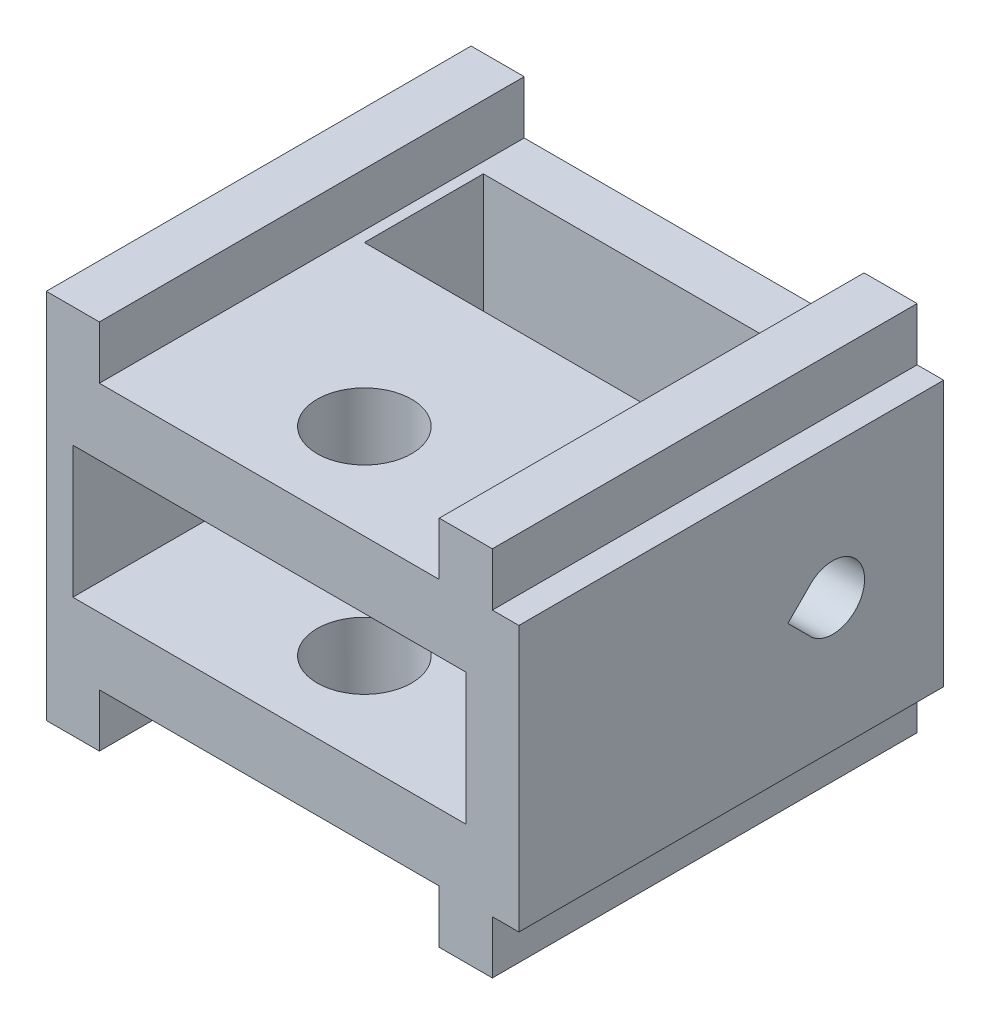
from build123d import *

# Parameters (mm, degrees)
SKETCH1_W               = 42
SKETCH1_H               = 40
BOSS_EXTRUDE1_DEPTH     = 25
SKETCH2_R               = 4.45
SKETCH2_W               = 30
SKETCH2_H               = 11.2
CUT_EXTRUDE1_DEPTH      = 25
SKETCH5_W               = 37
SKETCH5_H               = 12.4
CUT_EXTRUDE3_DEPTH      = 23.95
SKETCH7_W               = 5
SKETCH7_H               = 40
BOSS_EXTRUDE2_DEPTH     = 5
SKETCH8_W               = 5
SKETCH8_H               = 40
BOSS_EXTRUDE3_DEPTH     = 5
SKETCH10_W              = 40
SKETCH10_H              = 25
BOSS_EXTRUDE4_DEPTH     = 2.5
CUT_EXTRUDE2_DEPTH      = 66.743841816
CUT_EXTRUDE2_DEPTH_BACK = 66.743841816


with BuildPart() as part:
    # Sketch1 → Boss-Extrude1 (new body)
    with BuildSketch(Plane(origin=(0, 0, 0), x_dir=(-1, 0, 0), z_dir=(0, 1, 0))):
        with Locations((1.474226804, 20.721649485)):
            Rectangle(SKETCH1_W, SKETCH1_H)
    extrude(amount=BOSS_EXTRUDE1_DEPTH)

    # Sketch2 → Cut-Extrude1 (cut)
    with BuildSketch(Plane(origin=(0, 25, 0), x_dir=(-1, 0, 0), z_dir=(0, 1, 0))):
        with Locations(Location((1.474226804, 31.771649485, 0), (0, 0, 90))):
            Circle(SKETCH2_R)
        with Locations((1.474226804, 11.171649485)):
            Rectangle(SKETCH2_W, SKETCH2_H)
    extrude(amount=-CUT_EXTRUDE1_DEPTH, mode=Mode.SUBTRACT)

    # Sketch5 → Cut-Extrude3 (cut)
    with BuildSketch(Plane.XY.offset(40.721649485)):
        with Locations((-1.474226804, 12.5)):
            Rectangle(SKETCH5_W, SKETCH5_H)
    extrude(amount=-CUT_EXTRUDE3_DEPTH, mode=Mode.SUBTRACT)

    # Sketch7 → Boss-Extrude2 (add)
    with BuildSketch(Plane(origin=(0, 25, 0), x_dir=(-1, 0, 0), z_dir=(0, 1, 0))):
        with Locations((19.974226804, 20.721649485)):
            Rectangle(SKETCH7_W, SKETCH7_H)
        with Locations((-17.025773196, 20.721649485)):
            Rectangle(SKETCH7_W, SKETCH7_H)
    extrude(amount=BOSS_EXTRUDE2_DEPTH)

    # Sketch8 → Boss-Extrude3 (add)
    with BuildSketch(Plane.XZ):
        with Locations((-19.974226804, 20.721649485)):
            Rectangle(SKETCH8_W, SKETCH8_H)
        with Locations((17.025773196, 20.721649485)):
            Rectangle(SKETCH8_W, SKETCH8_H)
    extrude(amount=BOSS_EXTRUDE3_DEPTH)

    # Sketch10 → Boss-Extrude4 (add)
    with BuildSketch(Plane(origin=(19.525773196, 0, 0), x_dir=(0, 0, -1), z_dir=(1, 0, 0))):
        with Locations((-20.721649485, 12.5)):
            Rectangle(SKETCH10_W, SKETCH10_H)
    extrude(amount=BOSS_EXTRUDE4_DEPTH)

    # Sketch3 → Cut-Extrude2 (cut, two sides: drawn at the far end of the back side and taken through both)
    with BuildSketch(Plane.YZ.offset(19.525773196).offset(-CUT_EXTRUDE2_DEPTH_BACK)):
        with BuildLine():
            Line((14.423560576, 13.473803847), (12.5, 15.397364423))
            Line((12.5, 15.397364423), (10.576439424, 13.473803847))
            ThreePointArc((10.576439424, 13.473803847), (12.5, 8.171649485), (14.423560576, 13.473803847))
        make_face()
    extrude(amount=CUT_EXTRUDE2_DEPTH + CUT_EXTRUDE2_DEPTH_BACK, mode=Mode.SUBTRACT)


solid = part.part
